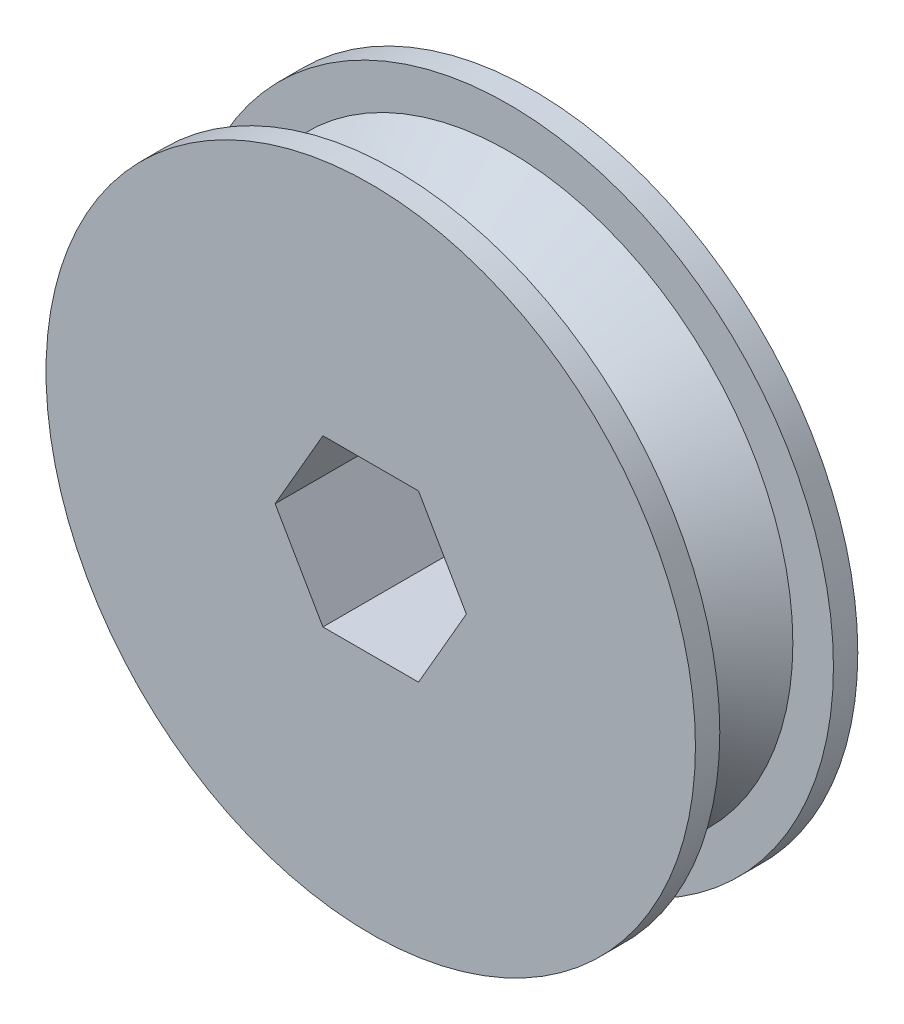
from build123d import *

# Parameters (mm, degrees)
SKETCH1_R           = 25.4
BOSS_EXTRUDE1_DEPTH = 6.35
CUT_EXTRUDE1_DEPTH  = 39.1


with BuildPart() as part:
    # Sketch1 → Boss-Extrude1 (new, symmetric)
    with BuildSketch(Plane.XY):
        Circle(SKETCH1_R)
    extrude(amount=BOSS_EXTRUDE1_DEPTH, both=True)

    # Sketch3 → Cut-Revolve1 (revolve, cut)
    with BuildSketch(Plane(origin=(0, 0, 0), x_dir=(1, 0, 0), z_dir=(0, 1, 0)), mode=Mode.PRIVATE) as cut_revolve1_sk:
        Polygon((-25.4, 4.445), (-25.4, -4.445), (-22.225, -4.445), (-17.78, 0), (-22.225, 4.445), align=None)
    revolve(cut_revolve1_sk.sketch.rotate(Axis((0, 0, 17.119668281), (0, 0, -1)), 180), axis=Axis((0, 0, 17.119668281), (0, 0, -1)), mode=Mode.SUBTRACT)

    # Sketch4 → Cut-Extrude1 (cut, through all)
    with BuildSketch(Plane(origin=(0, 0, -6.35), x_dir=(-1, 0, 0), z_dir=(0, 0, -1))):
        Polygon((7.478995387, 0), (3.739497694, 6.477), (-3.739497694, 6.477), (-7.478995387, 0), (-3.739497694, -6.477), (3.739497694, -6.477), align=None)
    extrude(amount=-CUT_EXTRUDE1_DEPTH, mode=Mode.SUBTRACT)


solid = part.part
